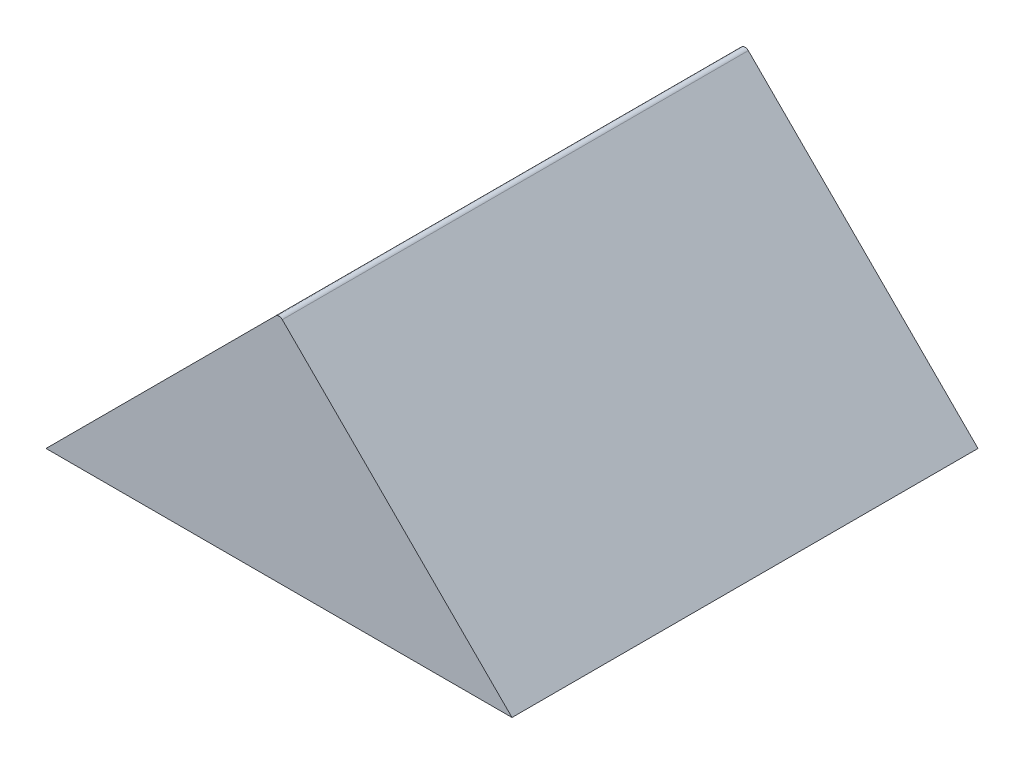
from build123d import *

# Parameters (mm, degrees)
SKETCH1_W           = 20
SKETCH1_H           = 20
BOSS_EXTRUDE1_DEPTH = 10
CUT_EXTRUDE1_DEPTH  = 20
CUT_EXTRUDE3_DEPTH  = 20
FILLET1_R           = 0.2


with BuildPart() as part:
    # Sketch1 → Boss-Extrude1 (new body)
    with BuildSketch(Plane(origin=(0, 0, 0), x_dir=(1, 0, 0), z_dir=(0, 1, 0))):
        Rectangle(SKETCH1_W, SKETCH1_H)
    extrude(amount=BOSS_EXTRUDE1_DEPTH)

    # Sketch2 → Cut-Extrude1 (cut)
    with BuildSketch(Plane.XY.offset(10)):
        Polygon((-10, 10), (-10, 0), (0, 10), align=None)
    extrude(amount=-CUT_EXTRUDE1_DEPTH, mode=Mode.SUBTRACT)

    # Sketch3 → Cut-Extrude3 (cut)
    with BuildSketch(Plane.XY.offset(10)):
        Polygon((0, 10), (10, 10), (10, 0), align=None)
    extrude(amount=-CUT_EXTRUDE3_DEPTH, mode=Mode.SUBTRACT)

    # Fillet1
    fillet1_edges = [part.edges().sort_by_distance(p)[0] for p in [
        (0, 10, 0),
    ]]
    fillet(fillet1_edges, radius=FILLET1_R)


solid = part.part
